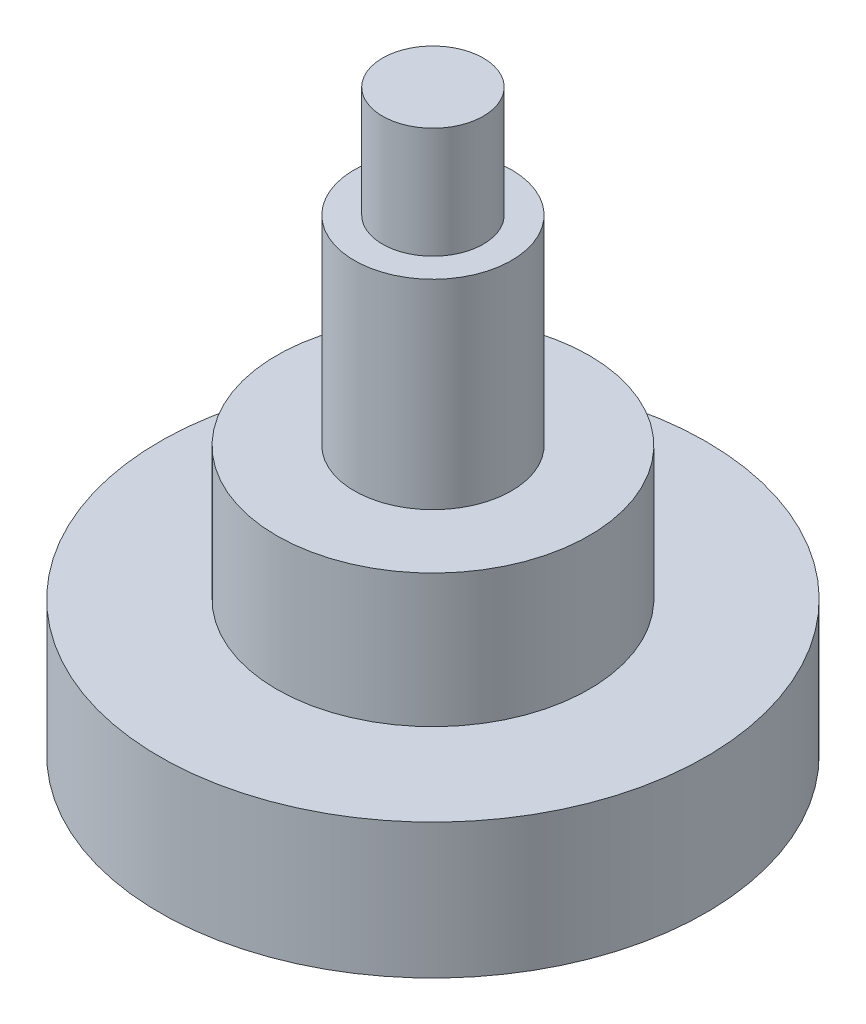
from build123d import *


with BuildPart() as part:
    # ｽｹｯﾁ1 → 回転1 (revolve)
    with BuildSketch(Plane.XY, mode=Mode.PRIVATE) as revolve_1_sk:
        Polygon((0, 0), (0, 17.1), (1.25, 17.1), (1.25, 14.35), (1.95, 14.35), (1.95, 9.4), (3.875, 9.4), (3.875, 6.1), (6.775, 6.1), (6.775, 2.75), (1.25, 2.75), (1.25, 0), align=None)
    revolve(revolve_1_sk.sketch.rotate(Axis((0, 0, 0), (0, 1, 0)), 90), axis=Axis((0, 0, 0), (0, 1, 0)))


solid = part.part
